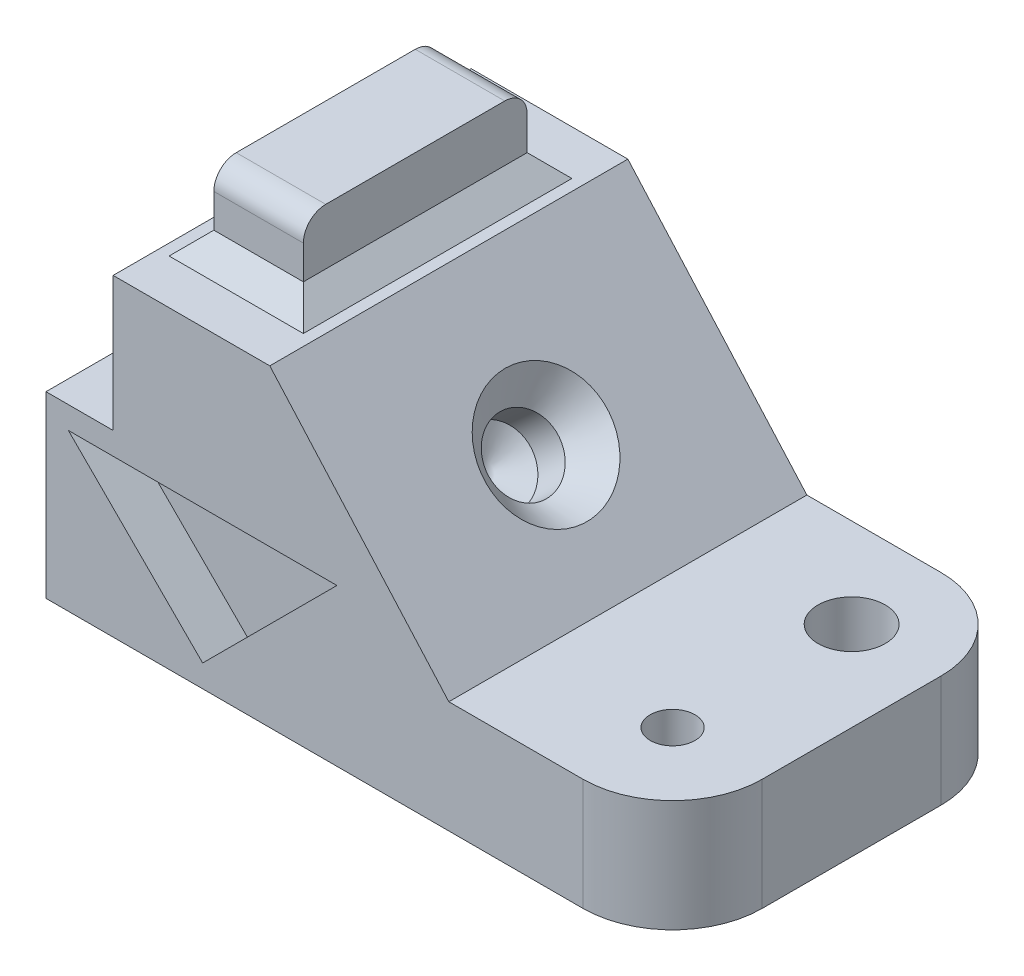
from build123d import *

# Parameters (mm, degrees)
BOSS_EXTRUDE1_DEPTH                              = 101.6
BOSS_EXTRUDE2_DEPTH                              = 12.7
CHAMFER1_SIZE                                    = 6.35
FILLET1_R                                        = 25.4
CUT_EXTRUDE2_DEPTH                               = 12.7
CSK_FOR_3_4_FLAT_HEAD_MACHINE_SCREW1_D           = 19.84248
CSK_FOR_3_4_FLAT_HEAD_MACHINE_SCREW1_DEPTH       = 19.05
CSK_FOR_3_4_FLAT_HEAD_MACHINE_SCREW1_CSINK_D     = 34.925
CSK_FOR_3_4_FLAT_HEAD_MACHINE_SCREW1_CSINK_ANGLE = 82
CSK_FOR_3_4_FLAT_HEAD_MACHINE_SCREW1_TIP         = 5.961282408
F_3_4_0_75_DIAMETER_HOLE1_D                      = 19.05
F_1_2_0_5_DIAMETER_HOLE1_D                       = 12.7


with BuildPart() as part:
    # Sketch1 → Boss-Extrude1 (new body)
    with BuildSketch(Plane.XY):
        Polygon((0, 0), (0, 50.8), (19.05, 50.8), (19.05, 88.9), (63.5, 88.9), (114.3, 31.75), (177.8, 31.75), (177.8, 0), align=None)
    extrude(amount=BOSS_EXTRUDE1_DEPTH)

    # Sketch2 → Boss-Extrude2 (add, symmetric)
    with BuildSketch(Plane.ZY.offset(-41.275)):
        with BuildLine():
            Line((25.4, 111.125), (76.2, 111.125))
            ThreePointArc((76.2, 111.125), (80.690128061, 109.265128061), (82.55, 104.775))
            Line((82.55, 104.775), (82.55, 88.9))
            Line((82.55, 88.9), (19.05, 88.9))
            Line((19.05, 88.9), (19.05, 104.775))
            ThreePointArc((19.05, 104.775), (20.909871939, 109.265128061), (25.4, 111.125))
        make_face()
    extrude(amount=BOSS_EXTRUDE2_DEPTH, both=True)

    # Chamfer1
    chamfer1_edges = [part.edges().sort_by_distance(p)[0] for p in [
        (53.975, 88.9, 50.8),
        (41.275, 88.9, 19.05),
        (41.275, 88.9, 82.55),
        (28.575, 88.9, 50.8),
    ]]
    chamfer(chamfer1_edges, length=CHAMFER1_SIZE)

    # Fillet1
    fillet1_edges = [part.edges().sort_by_distance(p)[0] for p in [
        (177.8, 15.875, 0),
        (177.8, 15.875, 101.6),
    ]]
    fillet(fillet1_edges, radius=FILLET1_R)

    # Sketch5 → Cut-Extrude2 (cut)
    with BuildSketch(Plane.XY.offset(101.6)):
        Polygon((6.35, 44.45), (82.55, 44.45), (44.45, 6.35), align=None)
    extrude(amount=-CUT_EXTRUDE2_DEPTH, mode=Mode.SUBTRACT)

    # CSK for 3/4 Flat Head Machine Screw1
    with Locations(Plane(origin=(79.615862069, 70.769655172, 0), x_dir=(0, 0, -1), z_dir=(0.7474093186836597, 0.6643638388299198, 0))):
        with Locations((-50.8, -17.28154091)):
            CounterSinkHole(CSK_FOR_3_4_FLAT_HEAD_MACHINE_SCREW1_D / 2, CSK_FOR_3_4_FLAT_HEAD_MACHINE_SCREW1_CSINK_D / 2, depth=CSK_FOR_3_4_FLAT_HEAD_MACHINE_SCREW1_DEPTH, counter_sink_angle=CSK_FOR_3_4_FLAT_HEAD_MACHINE_SCREW1_CSINK_ANGLE)
            with Locations((0, 0, -(CSK_FOR_3_4_FLAT_HEAD_MACHINE_SCREW1_DEPTH + CSK_FOR_3_4_FLAT_HEAD_MACHINE_SCREW1_TIP / 2))):  # 118° drill point
                Cone(0, CSK_FOR_3_4_FLAT_HEAD_MACHINE_SCREW1_D / 2, CSK_FOR_3_4_FLAT_HEAD_MACHINE_SCREW1_TIP, mode=Mode.SUBTRACT)

    # 3/4 (0.75) Diameter Hole1 (through all)
    with Locations(Plane(origin=(0, 0, 0), x_dir=(-1, 0, 0), z_dir=(0, -1, 0))):
        with Locations((-152.4, -25.4)):
            Hole(F_3_4_0_75_DIAMETER_HOLE1_D / 2)

    # 1/2 (0.5) Diameter Hole1 (through all)
    with Locations(Plane(origin=(0, 0, 0), x_dir=(-1, 0, 0), z_dir=(0, -1, 0))):
        with Locations((-152.4, -76.2)):
            Hole(F_1_2_0_5_DIAMETER_HOLE1_D / 2)


solid = part.part
